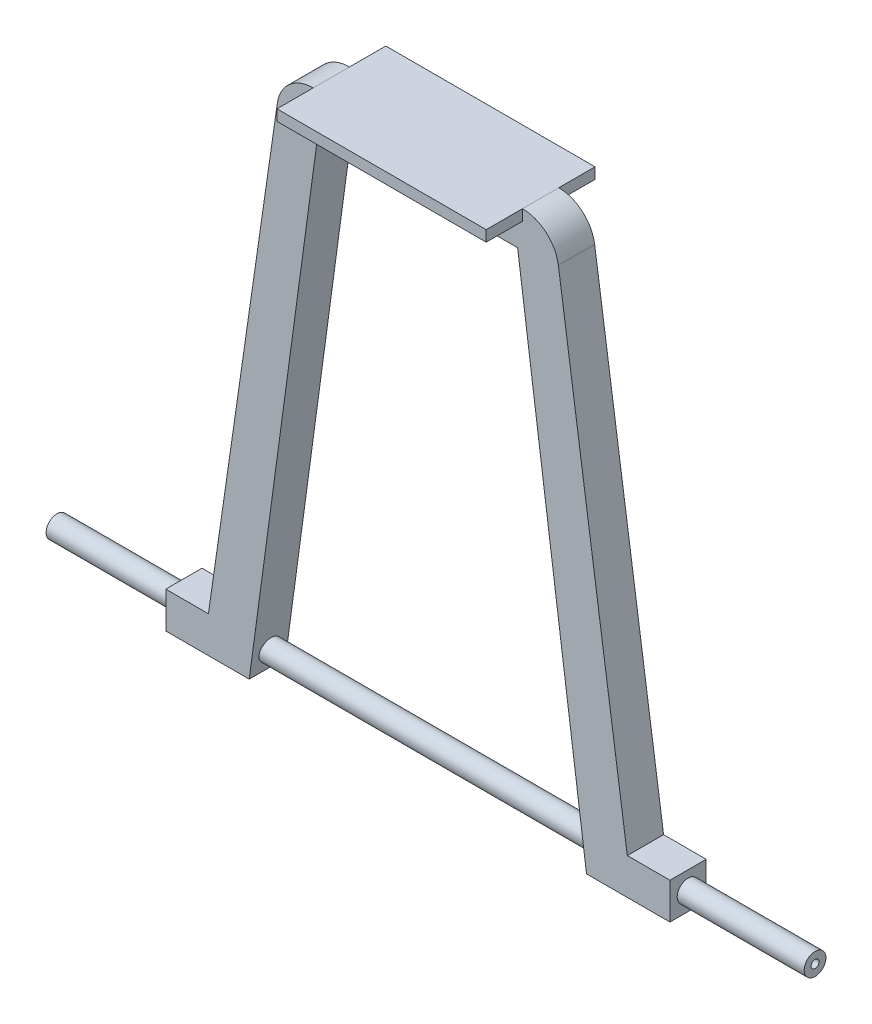
from build123d import *

# Parameters (mm, degrees)
SKETCH1_W           = 55
SKETCH1_H           = 10
BOSS_EXTRUDE1_DEPTH = 10
BOSS_EXTRUDE2_DEPTH = 10
SKETCH6_W           = 10
SKETCH6_H           = 10
BOSS_EXTRUDE3_DEPTH = 52
SKETCH7_W           = 57.683812306
SKETCH7_H           = 30
BOSS_EXTRUDE4_DEPTH = 3
SKETCH9_OUTSIDE_W   = 83.8
SKETCH9_OUTSIDE_H   = 203.8
SKETCH9_OUTSIDE_R   = 3
CUT_EXTRUDE1_DEPTH  = 35
SKETCH10_OUTSIDE_W  = 83.8
SKETCH10_OUTSIDE_H  = 203.8
SKETCH10_OUTSIDE_R  = 3
CUT_EXTRUDE2_DEPTH  = 35
BOSS_EXTRUDE6_REACH = 254.351
SKETCH14_R          = 3
SKETCH15_R          = 1.1
CUT_EXTRUDE3_DEPTH  = 230


with BuildPart() as part:
    # Sketch1 → Boss-Extrude1 (new body)
    with BuildSketch(Plane.XY):
        with Locations((27.5, 5)):
            Rectangle(SKETCH1_W, SKETCH1_H)
    extrude(amount=BOSS_EXTRUDE1_DEPTH)

    # Sketch3 → Boss-Extrude2 (add)
    with BuildSketch(Plane.XY.offset(10)):
        with BuildLine():
            Line((0, 0), (-18.993043386, -140))
            Line((-18.993043386, -140), (-31.688443832, -140))
            Line((-31.688443832, -140), (-11.238986316, 1.431015115))
            ThreePointArc((-11.238986316, 1.431015115), (-7.887509596, 7.56009759), (-1.341906153, 10))
            Line((-1.341906153, 10), (0, 10))
            Line((0, 10), (0, 0))
        make_face()
    boss_extrude2 = extrude(amount=-BOSS_EXTRUDE2_DEPTH)

    # Mirror1: Boss-Extrude2 across plane
    add(boss_extrude2.mirror(Plane(origin=(27.5, 0, 0), x_dir=(0, 0, 1), z_dir=(1, 0, 0))))

    # Sketch6 → Boss-Extrude3 (add)
    with BuildSketch(Plane(origin=(80, 0, 0), x_dir=(0, 0, -1), z_dir=(1, 0, 0))):
        with Locations((-5, -135)):
            Rectangle(SKETCH6_W, SKETCH6_H)
    boss_extrude3 = extrude(amount=BOSS_EXTRUDE3_DEPTH)

    # Mirror2: Boss-Extrude3 across plane
    add(boss_extrude3.mirror(Plane(origin=(27.5, 0, 0), x_dir=(0, 0, 1), z_dir=(1, 0, 0))))

    # Sketch7 → Boss-Extrude4 (add)
    with BuildSketch(Plane(origin=(0, 10, 0), x_dir=(1, 0, 0), z_dir=(0, 1, 0))):
        with Locations((27.5, -5)):
            Rectangle(SKETCH7_W, SKETCH7_H)
    extrude(amount=-BOSS_EXTRUDE4_DEPTH)

    # Sketch9 outside → Cut-Extrude1 (cut)
    with BuildSketch(Plane.ZY.offset(77)):
        with Locations((5, -65)):
            Rectangle(SKETCH9_OUTSIDE_W, SKETCH9_OUTSIDE_H)
        with Locations((5, -135)):
            Circle(SKETCH9_OUTSIDE_R, mode=Mode.SUBTRACT)
    extrude(amount=-CUT_EXTRUDE1_DEPTH, mode=Mode.SUBTRACT)

    # Sketch10 outside → Cut-Extrude2 (cut)
    with BuildSketch(Plane(origin=(132, 0, 0), x_dir=(0, 0, -1), z_dir=(1, 0, 0))):
        with Locations((-5, -65)):
            Rectangle(SKETCH10_OUTSIDE_W, SKETCH10_OUTSIDE_H)
        with Locations(Location((-5, -135, 0), (0, 0, 180))):
            Circle(SKETCH10_OUTSIDE_R, mode=Mode.SUBTRACT)
    extrude(amount=-CUT_EXTRUDE2_DEPTH, mode=Mode.SUBTRACT)

    # Boss-Extrude6: up to this plane
    boss_extrude6_end = Plane(origin=(0, 0, 0), z_dir=(-0.9909226687301317, 0.13443312313843575, 0))
    # Sketch14 → Boss-Extrude6 (add, up to the surface)
    with BuildSketch(Plane(origin=(132, 0, 0), x_dir=(0, 0, -1), z_dir=(1, 0, 0)), mode=Mode.PRIVATE) as boss_extrude6_sk1:
        with Locations(Location((-5, -135, 0), (0, 0, 180))):
            Circle(SKETCH14_R)
    boss_extrude6_tool1 = split(extrude(boss_extrude6_sk1.sketch, amount=-BOSS_EXTRUDE6_REACH, mode=Mode.PRIVATE), bisect_by=boss_extrude6_end, keep=Keep.BOTH, mode=Mode.PRIVATE)
    add(boss_extrude6_tool1.solids().sort_by_distance((132, -135, 5))[0])

    # Sketch15 → Cut-Extrude3 (cut)
    with BuildSketch(Plane.ZY.offset(77)):
        with Locations((5, -135)):
            Circle(SKETCH15_R)
    extrude(amount=-CUT_EXTRUDE3_DEPTH, mode=Mode.SUBTRACT)


solid = part.part
